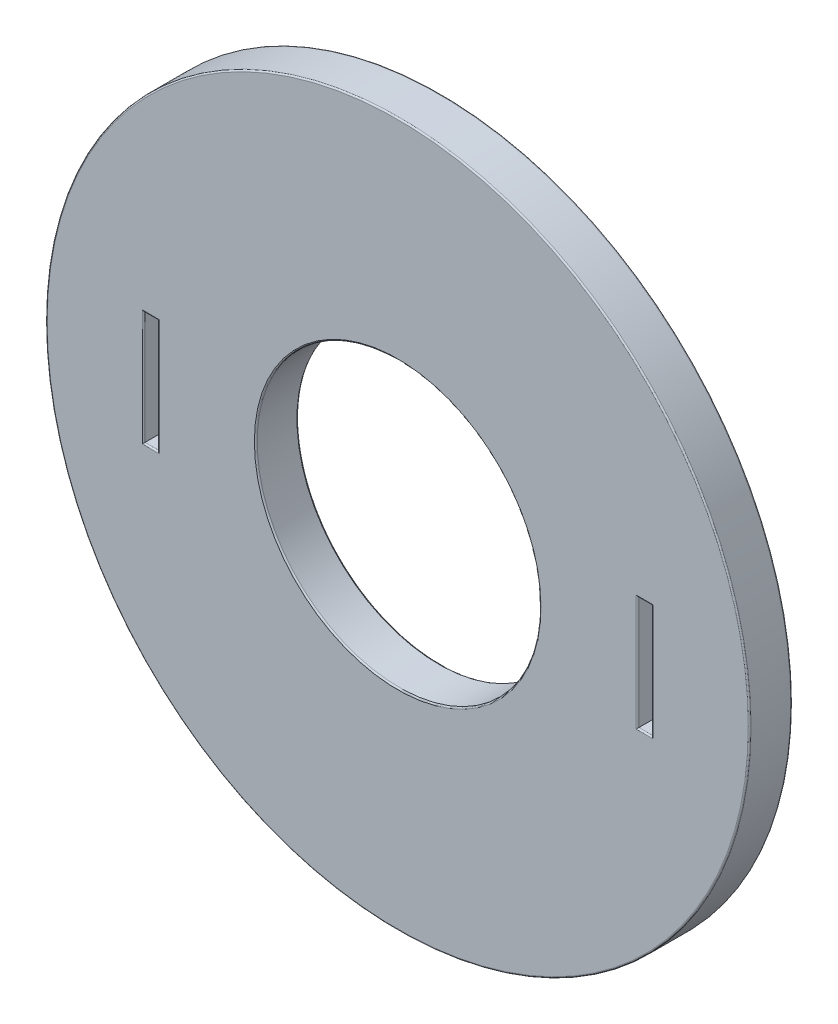
from build123d import *

# Parameters (mm, degrees)
SKETCH1_R           = 12.4
BOSS_EXTRUDE1_DEPTH = 1.5
SKETCH2_R           = 5
SKETCH2_W           = 0.5
SKETCH2_H           = 4
CUT_EXTRUDE1_DEPTH  = 18.600284089
FILLET1_R           = 0.05


with BuildPart() as part:
    # Sketch1 → Boss-Extrude1 (new body)
    with BuildSketch(Plane.XY):
        Circle(SKETCH1_R)
    extrude(amount=BOSS_EXTRUDE1_DEPTH)

    # Sketch2 → Cut-Extrude1 (cut, through all)
    with BuildSketch(Plane.XY.offset(1.5)):
        Circle(SKETCH2_R)
        with Locations((-8.7, 0)):
            Rectangle(SKETCH2_W, SKETCH2_H)
        with Locations((8.7, 0)):
            Rectangle(SKETCH2_W, SKETCH2_H)
    extrude(amount=-CUT_EXTRUDE1_DEPTH, mode=Mode.SUBTRACT)

    # Fillet1
    fillet1_edges = [part.edges().sort_by_distance(p)[0] for p in [
        (-8.95, 0, 0),
        (-8.7, 2, 0),
        (-8.45, 0, 0),
        (-8.7, -2, 0),
        (-8.95, 0, 1.5),
        (-8.7, -2, 1.5),
        (-8.45, 0, 1.5),
        (-8.7, 2, 1.5),
        (-12.4, 0, 0),
        (8.45, 0, 0),
        (8.7, 2, 0),
        (8.95, 0, 0),
        (8.7, -2, 0),
        (8.45, 0, 1.5),
        (8.7, -2, 1.5),
        (8.95, 0, 1.5),
        (8.7, 2, 1.5),
        (-12.4, 0, 1.5),
        (-5, 0, 0),
        (-5, 0, 1.5),
    ]]
    fillet(fillet1_edges, radius=FILLET1_R)


solid = part.part
